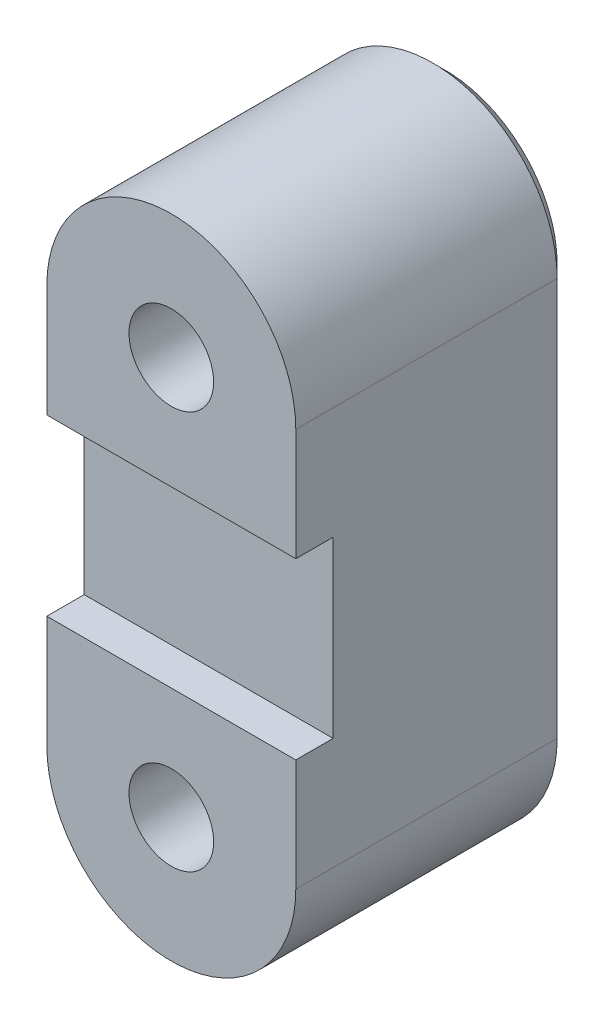
from build123d import *

# Parameters (mm, degrees)
SKETCH1_R           = 1.7
BOSS_EXTRUDE1_DEPTH = 11
SKETCH2_W           = 10
SKETCH2_H           = 7
CUT_EXTRUDE1_DEPTH  = 1.5
CHAMFER1_SIZE       = 0.5


with BuildPart() as part:
    # Sketch1 → Boss-Extrude1 (new body)
    with BuildSketch(Plane.XY):
        with BuildLine():
            Line((-5, -8), (-5, 8))
            ThreePointArc((-5, 8), (0, 13), (5, 8))
            Line((5, 8), (5, -8))
            ThreePointArc((5, -8), (0, -13), (-5, -8))
        make_face()
        with Locations((0, 8)):
            Circle(SKETCH1_R, mode=Mode.SUBTRACT)
        with Locations((0, -8)):
            Circle(SKETCH1_R, mode=Mode.SUBTRACT)
    extrude(amount=BOSS_EXTRUDE1_DEPTH)

    # Sketch2 → Cut-Extrude1 (cut)
    with BuildSketch(Plane.XY.offset(11)):
        Rectangle(SKETCH2_W, SKETCH2_H)
    extrude(amount=-CUT_EXTRUDE1_DEPTH, mode=Mode.SUBTRACT)

    # Chamfer1
    chamfer1_edges = [part.edges().sort_by_distance(p)[0] for p in [
        (-1.7, 8, 0),
        (-1.7, -8, 0),
        (-5, 0, 0),
        (0, 13, 0),
        (5, 0, 0),
        (0, -13, 0),
    ]]
    chamfer(chamfer1_edges, length=CHAMFER1_SIZE)


solid = part.part
